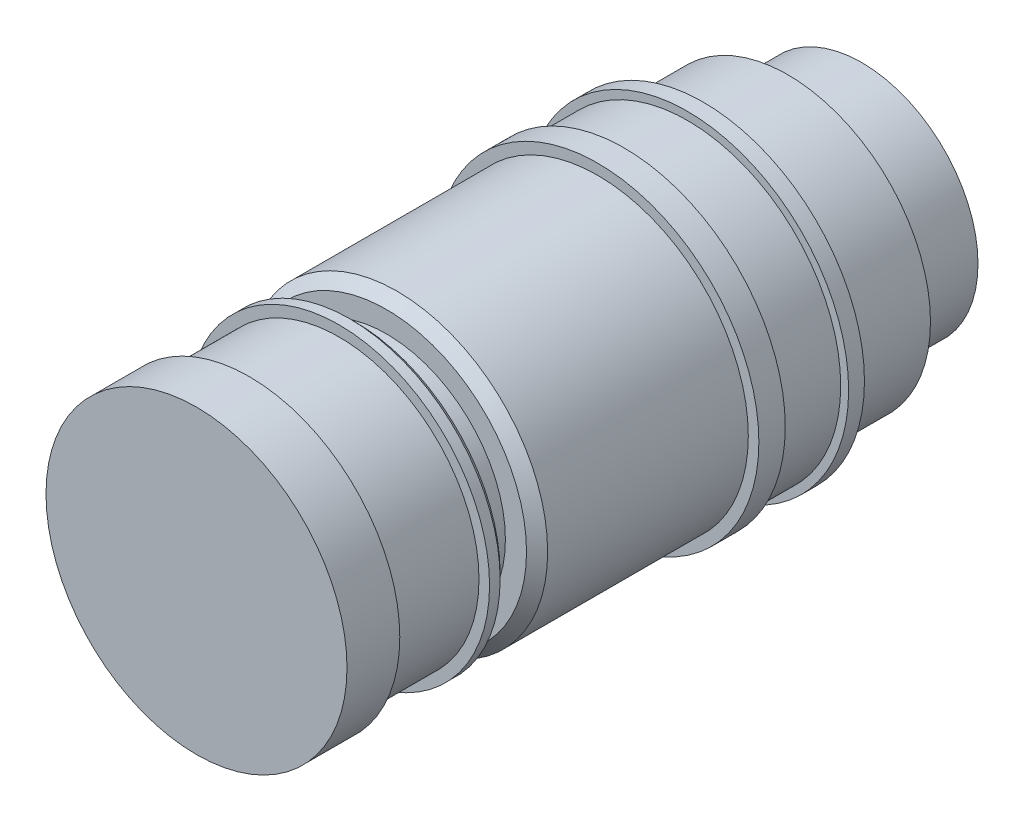
from build123d import *

# Parameters (mm, degrees)
SKETCH1_W     = 5
SKETCH1_H     = 14.25
SKETCH1_W_2   = 3
SKETCH1_H_2   = 11.25
SKETCH1_W_3   = 6
SKETCH1_H_3   = 14.5
SKETCH1_W_4   = 7
SKETCH1_H_4   = 11
CHAMFER1_SIZE = 1
CHAMFER2_SIZE = 0.5


with BuildPart() as part:
    # Sketch1 → Revolve1 (revolve)
    with BuildSketch(Plane(origin=(0, 0, 0), x_dir=(0, 0, -1), z_dir=(1, 0, 0)), mode=Mode.PRIVATE) as revolve1_sk:
        with Locations((2.5, 7.125)):
            Rectangle(SKETCH1_W, SKETCH1_H)
        Polygon((5, 13.25), (5, 0), (13.5, 0), (13.5, 11.25), (13.5, 13.25), align=None)
        Polygon((13.5, 11.25), (13.5, 0), (15, 0), (15, 11.25), (15, 14.25), (13.5, 14.25), (13.5, 13.25), align=None)
        with Locations((16.5, 5.625)):
            Rectangle(SKETCH1_W_2, SKETCH1_H_2)
        Polygon((18, 11.25), (18, 0), (38, 0), (38, 14.25), (18, 14.25), align=None)
        Polygon((38, 14.25), (38, 0), (40.5, 0), (40.5, 14.5), (40.5, 15.25), (38, 15.25), align=None)
        with Locations((43.5, 7.25)):
            Rectangle(SKETCH1_W_3, SKETCH1_H_3)
        Polygon((46.5, 14.5), (46.5, 0), (48, 0), (48, 13.5), (48, 15.25), (46.5, 15.25), align=None)
        Polygon((48, 13.5), (48, 0), (56, 0), (56, 11), (56, 13.5), align=None)
        with Locations((59.5, 5.5)):
            Rectangle(SKETCH1_W_4, SKETCH1_H_4)
    revolve(revolve1_sk.sketch.rotate(Axis((0, 0, -5), (0, 0, -1)), 90), axis=Axis((0, 0, -5), (0, 0, -1)))

    # Chamfer1
    chamfer1_edges = [part.edges().sort_by_distance(p)[0] for p in [
        (-14.25, 0, -18),
    ]]
    chamfer(chamfer1_edges, length=CHAMFER1_SIZE)

    # Chamfer2
    chamfer2_edges = [part.edges().sort_by_distance(p)[0] for p in [
        (-14.25, 0, -15),
    ]]
    chamfer(chamfer2_edges, length=CHAMFER2_SIZE)


solid = part.part
